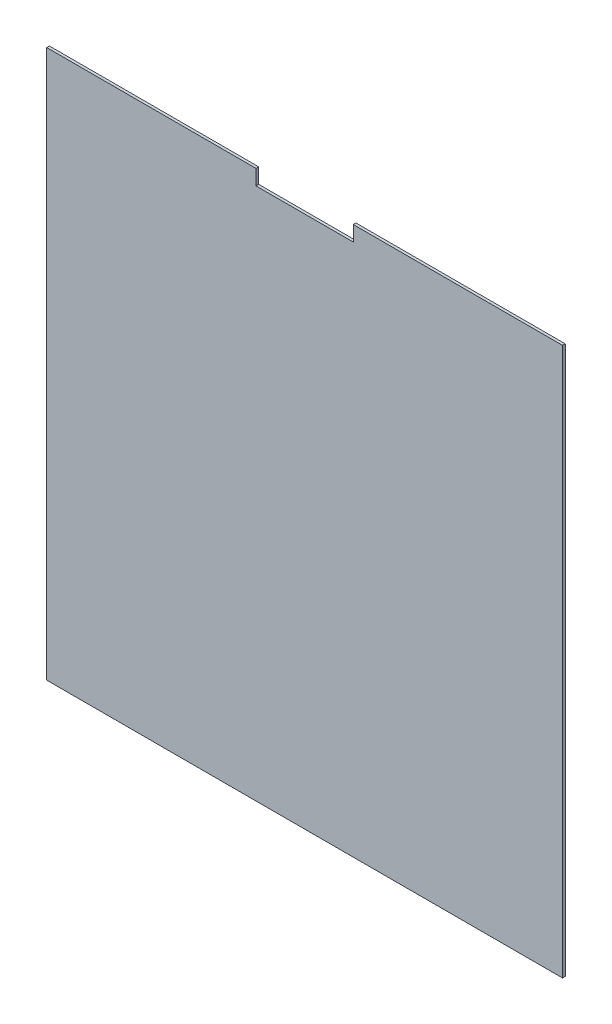
from build123d import *

# Parameters (mm, degrees)
BOSS_EXTRUDE1_DEPTH = 2
CUT_EXTRUDE1_START  = -29.245384
SKETCH2_W           = 382
SKETCH2_H           = 2
CUT_EXTRUDE1_DEPTH  = 29.245384


with BuildPart() as part:
    # Sketch1 → Boss-Extrude1 (new body)
    with BuildSketch(Plane.XY.offset(5)):
        Polygon((-50, 198.766085176), (-50, 210), (-205, 210), (-205, -225), (177, -225), (177, 210), (22, 210), (22, 198.766085176), align=None)
    extrude(amount=-BOSS_EXTRUDE1_DEPTH)

    # Sketch2 → Cut-Extrude1 (cut)
    with BuildSketch(Plane.XZ.offset(225).offset(CUT_EXTRUDE1_START)):
        with Locations((-14, 4)):
            Rectangle(SKETCH2_W, SKETCH2_H)
    extrude(amount=CUT_EXTRUDE1_DEPTH, mode=Mode.SUBTRACT)


solid = part.part
